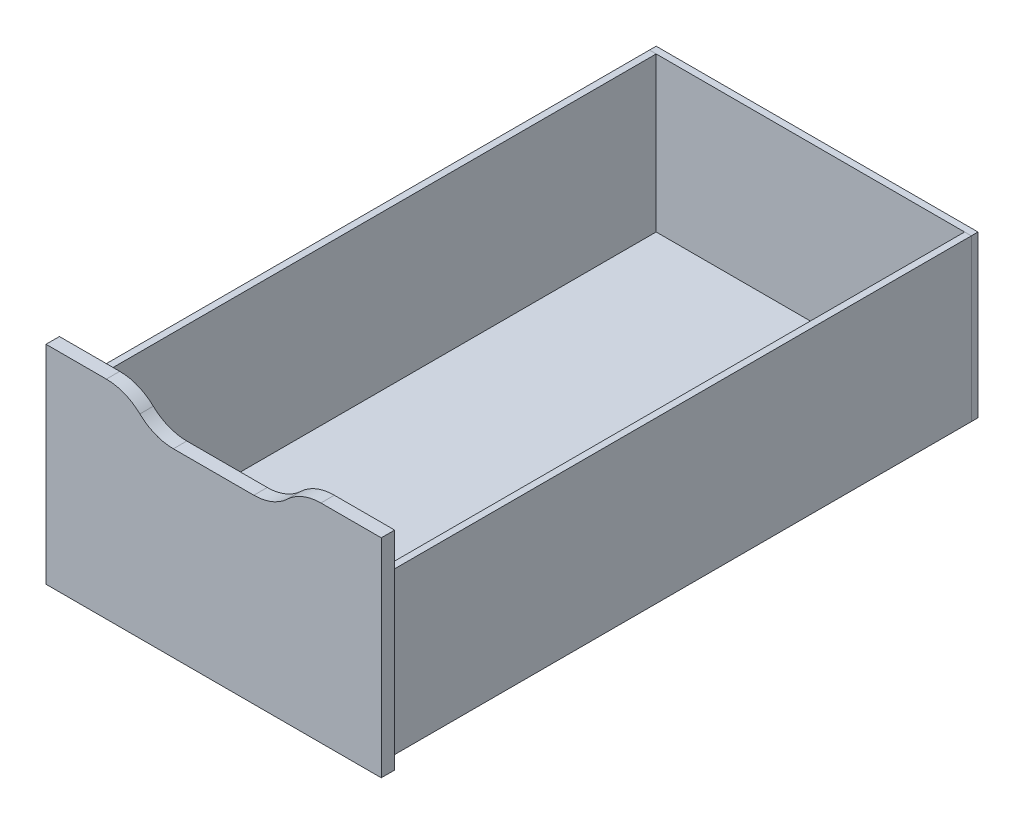
from build123d import *

# Parameters (mm, degrees)
SKETCH1_W           = 292.1
SKETCH1_H           = 552.45
BOSS_EXTRUDE1_DEPTH = 6.35
SKETCH2_W           = 317.5
SKETCH2_H           = 196.85
BOSS_EXTRUDE2_DEPTH = 12.7
CUT_EXTRUDE1_DEPTH  = 618.159894193
SKETCH4_W           = 552.45
SKETCH4_H           = 152.4
BOSS_EXTRUDE3_DEPTH = 6.35
SKETCH5_W           = 304.8
SKETCH5_H           = 152.4
BOSS_EXTRUDE4_DEPTH = 6.35


with BuildPart() as part:
    # Sketch1 → Boss-Extrude1 (new body)
    with BuildSketch(Plane(origin=(0, 0, 0), x_dir=(1, 0, 0), z_dir=(0, 1, 0))):
        with Locations((0, -3.175)):
            Rectangle(SKETCH1_W, SKETCH1_H)
    extrude(amount=BOSS_EXTRUDE1_DEPTH)


with BuildPart() as body_2:
    # Sketch2 → Boss-Extrude2 (new body)
    with BuildSketch(Plane.XY.offset(279.4)):
        with Locations((0, 92.075)):
            Rectangle(SKETCH2_W, SKETCH2_H)
    extrude(amount=BOSS_EXTRUDE2_DEPTH)

    # Sketch3 → Cut-Extrude1 (cut, through all)
    with BuildSketch(Plane.XY.offset(292.1)):
        with BuildLine():
            Line((-101.6, 203.2), (101.6, 203.2))
            Line((101.6, 203.2), (101.6, 190.5))
            ThreePointArc((101.6, 190.5), (84.502101737, 187.207245657), (69.85, 177.8))
            ThreePointArc((69.85, 177.8), (55.197898263, 168.392754343), (38.1, 165.1))
            Line((38.1, 165.1), (-38.1, 165.1))
            ThreePointArc((-38.1, 165.1), (-55.197898263, 168.392754343), (-69.85, 177.8))
            ThreePointArc((-69.85, 177.8), (-84.502101737, 187.207245657), (-101.6, 190.5))
            Line((-101.6, 190.5), (-101.6, 203.2))
        make_face()
    extrude(amount=-CUT_EXTRUDE1_DEPTH, mode=Mode.SUBTRACT)


with BuildPart() as body_3:
    # Sketch4 → Boss-Extrude3 (new body)
    with BuildSketch(Plane(origin=(146.05, 0, 0), x_dir=(0, 0, -1), z_dir=(1, 0, 0))):
        with Locations((-3.175, 76.2)):
            Rectangle(SKETCH4_W, SKETCH4_H)
    extrude(amount=BOSS_EXTRUDE3_DEPTH)


with BuildPart() as body_4:
    # Mirror2: mirrored copy
    add(body_3.part.mirror(Plane(origin=(0, 0, 0), x_dir=(0, 0, 1), z_dir=(1, 0, 0))))


with BuildPart() as body_5:
    # Sketch5 → Boss-Extrude4 (new body)
    with BuildSketch(Plane(origin=(0, 0, -273.05), x_dir=(-1, 0, 0), z_dir=(0, 0, -1))):
        with Locations((0, 76.2)):
            Rectangle(SKETCH5_W, SKETCH5_H)
    extrude(amount=BOSS_EXTRUDE4_DEPTH)


solid = Compound([part.part, body_2.part, body_3.part, body_4.part, body_5.part])
